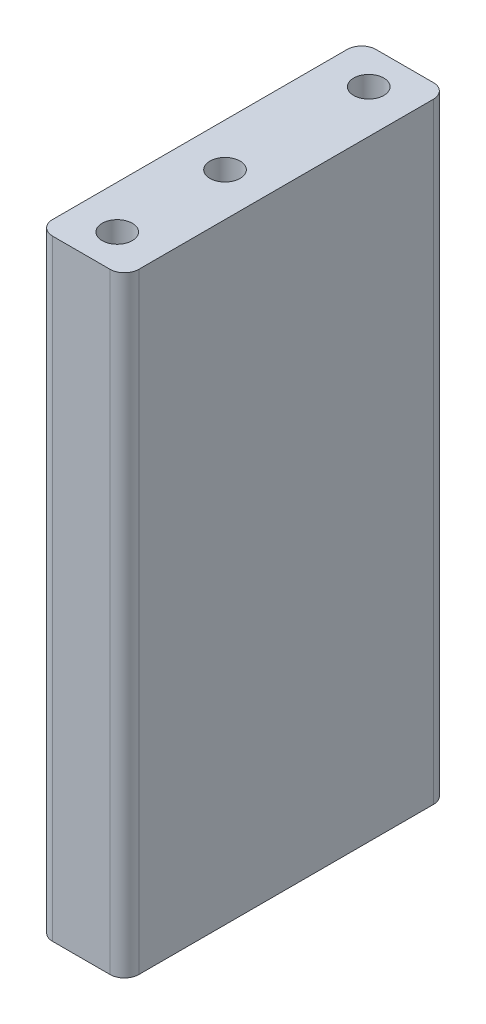
from build123d import *

# Parameters (mm, degrees)
SKETCH1_W                   = 12
SKETCH1_H                   = 45
BOSS_EXTRUDE1_DEPTH         = 85
TAP_DRILL_FOR_M5X0_8_TAP1_D = 4.2
FILLET1_R                   = 2


with BuildPart() as part:
    # Sketch1 → Boss-Extrude1 (new body)
    with BuildSketch(Plane(origin=(0, 0, 0), x_dir=(1, 0, 0), z_dir=(0, 1, 0))):
        with Locations((0, -7.5)):
            Rectangle(SKETCH1_W, SKETCH1_H)
    extrude(amount=-BOSS_EXTRUDE1_DEPTH)

    # Tap Drill for M5x0.8 Tap1 (through all)
    with Locations(Plane(origin=(0, 0, -10), x_dir=(0, 0, 1), z_dir=(0, 1, 0))):
        with Locations((0, 0), (20, 0), (35, 0)):
            Hole(TAP_DRILL_FOR_M5X0_8_TAP1_D / 2)

    # Fillet1
    fillet1_edges = [part.edges().sort_by_distance(p)[0] for p in [
        (6, -42.5, 30),
        (-6, -42.5, 30),
        (-6, -42.5, -15),
        (6, -42.5, -15),
    ]]
    fillet(fillet1_edges, radius=FILLET1_R)


solid = part.part
